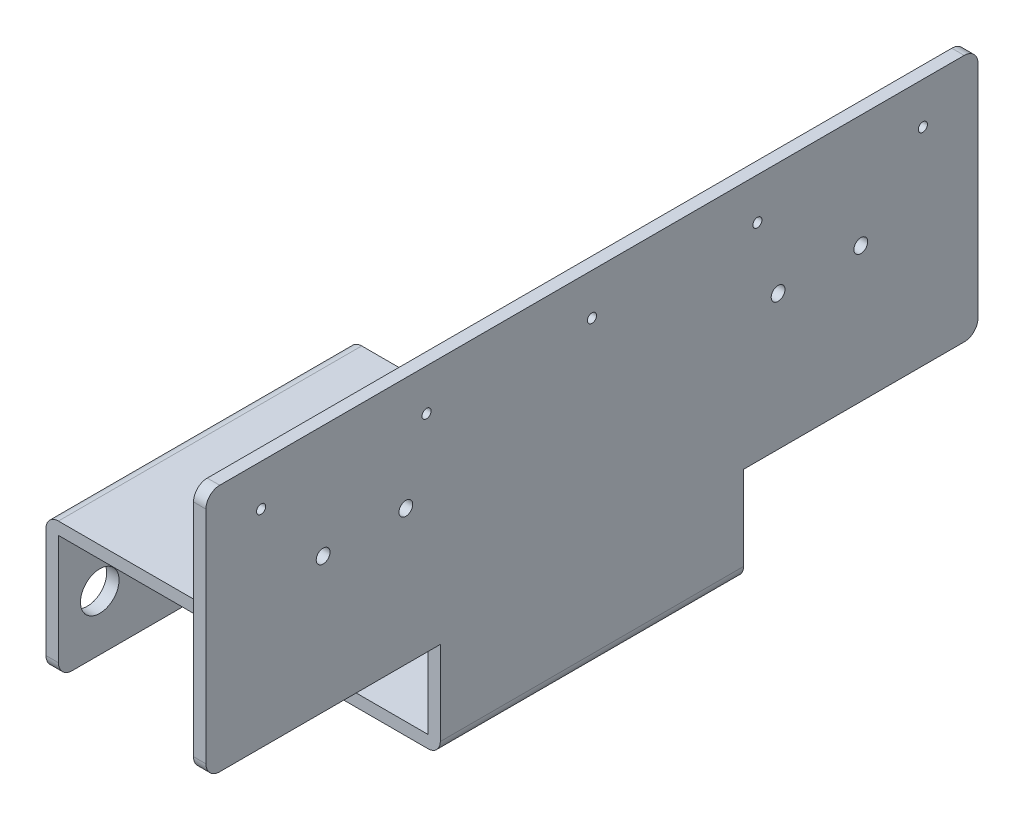
from build123d import *

# Parameters (mm, degrees)
EXTRUDE_1_DEPTH          = 55
EXTRUDE_1_DEPTH_BACK     = 55
EXTRUDE_2_DEPTH          = 140
EXTRUDE_2_DEPTH_BACK     = 140
SKETCH_2_W               = 4.5
SKETCH_2_H               = 90
FILLET_1_R               = 5
CUT_EXTRUDE_1_DEPTH      = 263.581415946
CUT_EXTRUDE_1_DEPTH_BACK = 263.581415946
SKETCH_3_R               = 7
SKETCH_3_R_2             = 1.65
SKETCH_3_R_3             = 2.5


with BuildPart() as part:
    # ｽｹｯﾁ1 → ﾎﾞｽ - 押し出し1 (new, two sides: drawn at the far end of the back side and taken through both)
    with BuildSketch(Plane.XY.offset(-EXTRUDE_1_DEPTH_BACK)):
        with BuildLine():
            Line((0, 0), (4.5, 0))
            Line((4.5, 0), (4.5, 45))
            Line((4.5, 45), (138.5, 45))
            ThreePointArc((138.5, 45), (141.681980515, 46.318019485), (143, 49.5))
            Line((143, 49.5), (143, 170))
            Line((143, 170), (138.5, 170))
            Line((138.5, 170), (138.5, 49.5))
            Line((138.5, 49.5), (4.5, 49.5))
            ThreePointArc((4.5, 49.5), (1.318019485, 48.181980515), (0, 45))
            Line((0, 45), (0, 0))
        make_face()
    extrude(amount=EXTRUDE_1_DEPTH + EXTRUDE_1_DEPTH_BACK)

    # ｽｹｯﾁ2 → ﾎﾞｽ - 押し出し2 (add, two sides: drawn at the far end of the back side and taken through both)
    with BuildSketch(Plane.XY.offset(-EXTRUDE_2_DEPTH_BACK)):
        with Locations((140.75, 125)):
            Rectangle(SKETCH_2_W, SKETCH_2_H)
    extrude(amount=EXTRUDE_2_DEPTH + EXTRUDE_2_DEPTH_BACK)

    # ﾌｨﾚｯﾄ1
    fillet_1_edges = [part.edges().sort_by_distance(p)[0] for p in [
        (140.75, 80, -140),
        (140.75, 170, -140),
        (140.75, 80, 140),
        (140.75, 170, 140),
        (2.25, 0, -55),
        (2.25, 0, 55),
    ]]
    fillet(fillet_1_edges, radius=FILLET_1_R)

    # ｽｹｯﾁ3 → ｶｯﾄ - 押し出し1 (cut, two sides: drawn at the far end of the back side and taken through both)
    with BuildSketch(Plane(origin=(0, 0, 0), x_dir=(0, 0, -1), z_dir=(1, 0, 0)).offset(-CUT_EXTRUDE_1_DEPTH_BACK)):
        with Locations((40, 20)):
            Circle(SKETCH_3_R)
        with Locations((-40, 20)):
            Circle(SKETCH_3_R)
        with Locations((0, 155)):
            Circle(SKETCH_3_R_2)
        with Locations((60, 155)):
            Circle(SKETCH_3_R_2)
        with Locations((-60, 155)):
            Circle(SKETCH_3_R_2)
        with Locations((120, 155)):
            Circle(SKETCH_3_R_2)
        with Locations((-120, 155)):
            Circle(SKETCH_3_R_2)
        with Locations((67.5, 129)):
            Circle(SKETCH_3_R_3)
        with Locations((-67.5, 129)):
            Circle(SKETCH_3_R_3)
        with Locations((97.5, 129)):
            Circle(SKETCH_3_R_3)
        with Locations((-97.5, 129)):
            Circle(SKETCH_3_R_3)
    extrude(amount=CUT_EXTRUDE_1_DEPTH + CUT_EXTRUDE_1_DEPTH_BACK, mode=Mode.SUBTRACT)


solid = part.part
